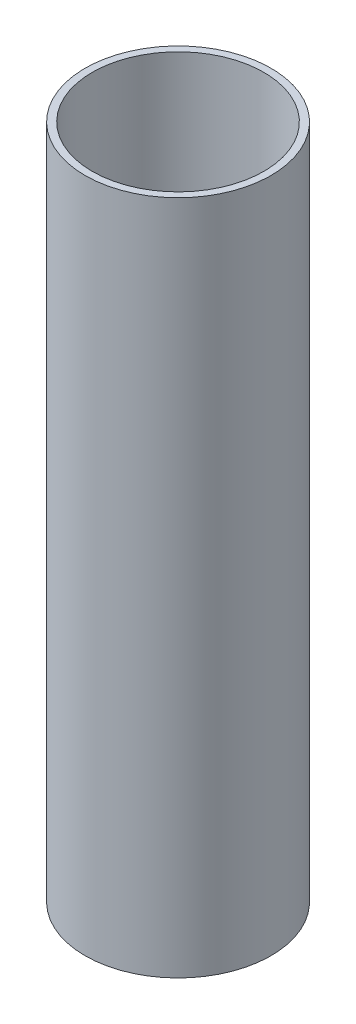
from build123d import *

# Parameters (mm, degrees)
SKETCH1_R           = 41.275
SKETCH1_R_2         = 38.1
BOSS_EXTRUDE1_DEPTH = 300


with BuildPart() as part:
    # Sketch1 → Boss-Extrude1 (new body)
    with BuildSketch(Plane(origin=(0, 0, 0), x_dir=(1, 0, 0), z_dir=(0, 1, 0))):
        with Locations(Location((0, 0, 0), (0, 0, 270))):
            Circle(SKETCH1_R)
        with Locations(Location((0, 0, 0), (0, 0, 270))):
            Circle(SKETCH1_R_2, mode=Mode.SUBTRACT)
    extrude(amount=BOSS_EXTRUDE1_DEPTH)


solid = part.part
